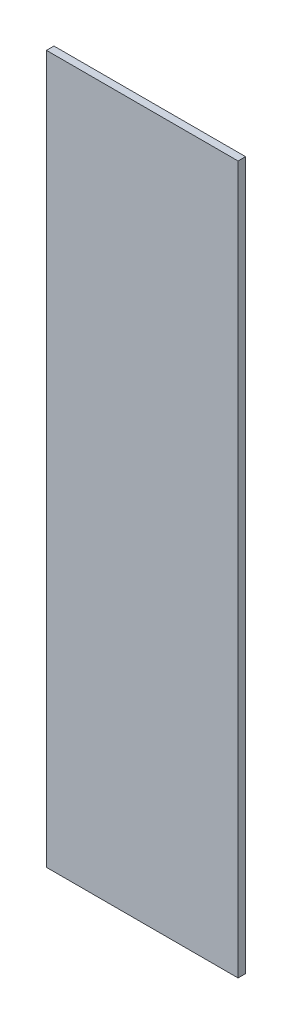
from build123d import *

# Parameters (mm, degrees)
BOSS_EXTRUDE1_DEPTH      = 12.7
BOSS_EXTRUDE1_DEPTH_BACK = 12.7
SKETCH1_W                = 650
SKETCH1_H                = 2400


with BuildPart() as part:
    # Sketch1 → Boss-Extrude1 (new, two sides: drawn at the far end of the back side and taken through both)
    with BuildSketch(Plane.XY.offset(-BOSS_EXTRUDE1_DEPTH_BACK)):
        Rectangle(SKETCH1_W, SKETCH1_H)
    extrude(amount=BOSS_EXTRUDE1_DEPTH + BOSS_EXTRUDE1_DEPTH_BACK)


solid = part.part
